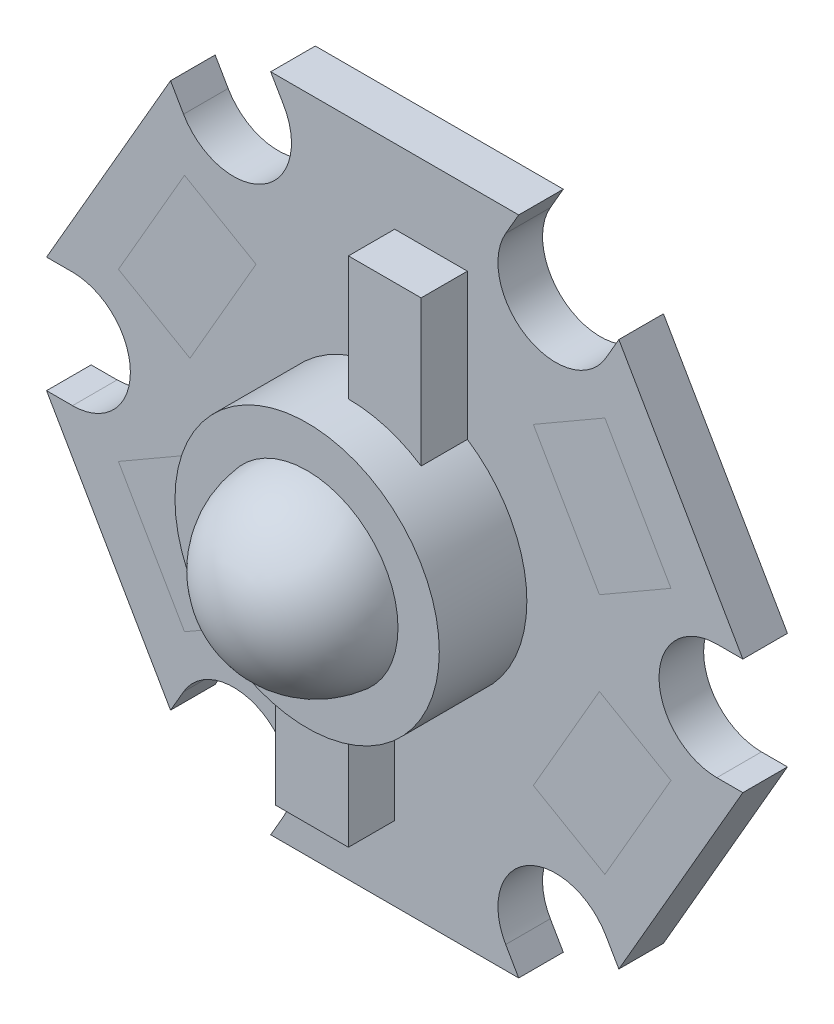
from build123d import *

# Parameters (mm, degrees)
BOSS_EXTRUDE1_DEPTH = 1.35
CUT_EXTRUDE1_DEPTH  = 16.334791597
CIRPATTERN1_COUNT   = 6
SKETCH5_W           = 2.2
SKETCH5_H           = 4.409341382
BOSS_EXTRUDE2_DEPTH = 1.4


with BuildPart() as part:
    # Sketch1 → Boss-Extrude1 (new body)
    with BuildSketch(Plane.XY):
        Polygon((5.773502692, 10), (-5.773502692, 10), (-11.547005384, 0), (-5.773502692, -10), (5.773502692, -10), (11.547005384, 0), align=None)
    extrude(amount=BOSS_EXTRUDE1_DEPTH)

    # Sketch2 → Cut-Extrude1 (cut, through all)
    with BuildSketch(Plane.XY.offset(1.35)):
        with BuildLine():
            Line((-9.75, 1.75), (-11.547005384, 1.75))
            Line((-11.547005384, 1.75), (-11.547005384, -1.75))
            Line((-11.547005384, -1.75), (-9.75, -1.75))
            ThreePointArc((-9.75, -1.75), (-8, 0), (-9.75, 1.75))
        make_face()
    cut_extrude1 = extrude(amount=-CUT_EXTRUDE1_DEPTH, mode=Mode.SUBTRACT)

    # CirPattern1: Cut-Extrude1 ×6 about axis
    cirpattern1_axis = Axis((0, 0, -0.0675), (0, 0, 1))
    for i in range(1, CIRPATTERN1_COUNT):
        add(cut_extrude1.rotate(cirpattern1_axis, i * 360 / CIRPATTERN1_COUNT), mode=Mode.SUBTRACT)

    # Sketch4 → Revolve1 (revolve)
    with BuildSketch(Plane(origin=(0, 0, 0), x_dir=(1, 0, 0), z_dir=(0, 1, 0))):
        with BuildLine():
            Line((-4, -1.35), (-4, -4))
            Line((-4, -4), (-2.75, -4))
            ThreePointArc((-2.75, -4), (-1.858258593, -5.781584453), (0, -6.5))
            Line((0, -6.5), (0, -1.35))
            Line((0, -1.35), (-4, -1.35))
        make_face()
    revolve(axis=Axis((0, 0, 6.5), (0, 0, -1)))

    # Sketch5 → Boss-Extrude2 (add)
    with BuildSketch(Plane.XY.offset(1.35)):
        with Locations((1.1, 5.545329309)):
            Rectangle(SKETCH5_W, SKETCH5_H)
        with Locations((-1.1, -5.545329309)):
            Rectangle(SKETCH5_W, SKETCH5_H)
    extrude(amount=BOSS_EXTRUDE2_DEPTH)


solid = part.part
